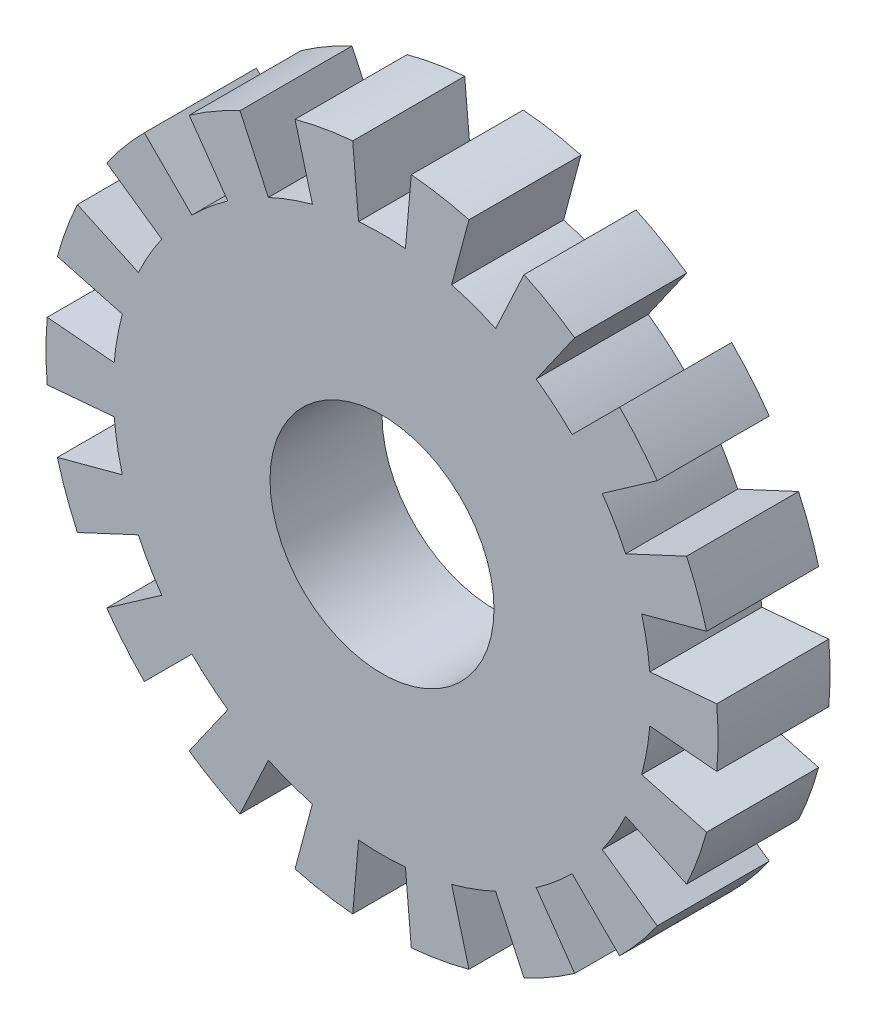
from build123d import *

# Parameters (mm, degrees)
SKETCH_1_R          = 15
EXTRUDE_1_DEPTH     = 5
CUT_EXTRUDE_1_REACH = 23.794
CUT_EXTRUDE_2_REACH = 23.755
SKETCH_3_R          = 5


with BuildPart() as part:
    # ｽｹｯﾁ1 → ﾎﾞｽ - 押し出し1 (new body)
    with BuildSketch(Plane.XY):
        Circle(SKETCH_1_R)
    extrude(amount=EXTRUDE_1_DEPTH)

    # ｽｹｯﾁ2 → ｶｯﾄ - 押し出し1 (cut, up to next)
    with BuildSketch(Plane(origin=(0, 0, 0), x_dir=(-1, 0, 0), z_dir=(0, 0, -1)), mode=Mode.PRIVATE) as cut_extrude_1_sk1:
        with BuildLine():
            Line((-6.882917236, 9.829824531), (-8.603646545, 12.287280664))
            ThreePointArc((-8.603646545, 12.287280664), (-9.641814145, 11.490666647), (-10.606601718, 10.606601718))
            Line((-10.606601718, 10.606601718), (-8.485281374, 8.485281374))
            ThreePointArc((-8.485281374, 8.485281374), (-7.713451316, 9.192533317), (-6.882917236, 9.829824531))
        make_face()
    cut_extrude_1_tool1 = extrude(cut_extrude_1_sk1.sketch, amount=-CUT_EXTRUDE_1_REACH, mode=Mode.PRIVATE) & part.part
    # ｽｹｯﾁ2 → ｶｯﾄ - 押し出し1 (cut, up to next)
    with BuildSketch(Plane(origin=(0, 0, 0), x_dir=(-1, 0, 0), z_dir=(0, 0, -1)), mode=Mode.PRIVATE) as cut_extrude_1_sk2:
        with BuildLine():
            Line((-3.105828541, 11.591109915), (-3.882285677, 14.488887394))
            ThreePointArc((-3.882285677, 14.488887394), (-5.13030215, 14.095389312), (-6.339273926, 13.594616806))
            Line((-6.339273926, 13.594616806), (-5.071419141, 10.875693444))
            ThreePointArc((-5.071419141, 10.875693444), (-4.10424172, 11.276311449), (-3.105828541, 11.591109915))
        make_face()
    cut_extrude_1_tool2 = extrude(cut_extrude_1_sk2.sketch, amount=-CUT_EXTRUDE_1_REACH, mode=Mode.PRIVATE) & part.part
    # ｽｹｯﾁ2 → ｶｯﾄ - 押し出し1 (cut, up to next)
    with BuildSketch(Plane(origin=(0, 0, 0), x_dir=(-1, 0, 0), z_dir=(0, 0, -1)), mode=Mode.PRIVATE) as cut_extrude_1_sk3:
        with BuildLine():
            ThreePointArc((0, 12), (0.523432648, 11.988578659), (1.045868913, 11.954336377))
            Line((1.045868913, 11.954336377), (1.307336141, 14.942920471))
            ThreePointArc((1.307336141, 14.942920471), (0.65429081, 14.985723324), (0, 15))
            Line((0, 15), (0, 12))
        make_face()
    cut_extrude_1_tool3 = extrude(cut_extrude_1_sk3.sketch, amount=-CUT_EXTRUDE_1_REACH, mode=Mode.PRIVATE) & part.part
    # ｽｹｯﾁ2 → ｶｯﾄ - 押し出し1 (cut, up to next)
    with BuildSketch(Plane(origin=(0, 0, 0), x_dir=(-1, 0, 0), z_dir=(0, 0, -1)), mode=Mode.PRIVATE) as cut_extrude_1_sk4:
        with BuildLine():
            ThreePointArc((-1.045868913, 11.954336377), (-0.523432648, 11.988578659), (0, 12))
            Line((0, 12), (0, 15))
            ThreePointArc((0, 15), (-0.65429081, 14.985723324), (-1.307336141, 14.942920471))
            Line((-1.307336141, 14.942920471), (-1.045868913, 11.954336377))
        make_face()
    cut_extrude_1_tool4 = extrude(cut_extrude_1_sk4.sketch, amount=-CUT_EXTRUDE_1_REACH, mode=Mode.PRIVATE) & part.part
    # ｽｹｯﾁ2 → ｶｯﾄ - 押し出し1 (cut, up to next)
    with BuildSketch(Plane(origin=(0, 0, 0), x_dir=(-1, 0, 0), z_dir=(0, 0, -1)), mode=Mode.PRIVATE) as cut_extrude_1_sk5:
        with BuildLine():
            ThreePointArc((6.339273926, 13.594616806), (5.13030215, 14.095389312), (3.882285677, 14.488887394))
            Line((3.882285677, 14.488887394), (3.105828541, 11.591109915))
            ThreePointArc((3.105828541, 11.591109915), (4.10424172, 11.276311449), (5.071419141, 10.875693444))
            Line((5.071419141, 10.875693444), (6.339273926, 13.594616806))
        make_face()
    cut_extrude_1_tool5 = extrude(cut_extrude_1_sk5.sketch, amount=-CUT_EXTRUDE_1_REACH, mode=Mode.PRIVATE) & part.part
    # ｽｹｯﾁ2 → ｶｯﾄ - 押し出し1 (cut, up to next)
    with BuildSketch(Plane(origin=(0, 0, 0), x_dir=(-1, 0, 0), z_dir=(0, 0, -1)), mode=Mode.PRIVATE) as cut_extrude_1_sk6:
        with BuildLine():
            ThreePointArc((10.606601718, 10.606601718), (9.641814145, 11.490666647), (8.603646545, 12.287280664))
            Line((8.603646545, 12.287280664), (6.882917236, 9.829824531))
            ThreePointArc((6.882917236, 9.829824531), (7.713451316, 9.192533317), (8.485281374, 8.485281374))
            Line((8.485281374, 8.485281374), (10.606601718, 10.606601718))
        make_face()
    cut_extrude_1_tool6 = extrude(cut_extrude_1_sk6.sketch, amount=-CUT_EXTRUDE_1_REACH, mode=Mode.PRIVATE) & part.part
    # ｽｹｯﾁ2 → ｶｯﾄ - 押し出し1 (cut, up to next)
    with BuildSketch(Plane(origin=(0, 0, 0), x_dir=(-1, 0, 0), z_dir=(0, 0, -1)), mode=Mode.PRIVATE) as cut_extrude_1_sk7:
        with BuildLine():
            ThreePointArc((13.594616806, 6.339273926), (12.990381057, 7.5), (12.287280664, 8.603646545))
            Line((12.287280664, 8.603646545), (9.829824531, 6.882917236))
            ThreePointArc((9.829824531, 6.882917236), (10.392304845, 6), (10.875693444, 5.071419141))
            Line((10.875693444, 5.071419141), (13.594616806, 6.339273926))
        make_face()
    cut_extrude_1_tool7 = extrude(cut_extrude_1_sk7.sketch, amount=-CUT_EXTRUDE_1_REACH, mode=Mode.PRIVATE) & part.part
    # ｽｹｯﾁ2 → ｶｯﾄ - 押し出し1 (cut, up to next)
    with BuildSketch(Plane(origin=(0, 0, 0), x_dir=(-1, 0, 0), z_dir=(0, 0, -1)), mode=Mode.PRIVATE) as cut_extrude_1_sk8:
        with BuildLine():
            ThreePointArc((14.942920471, 1.307336141), (14.772116295, 2.604722665), (14.488887394, 3.882285677))
            Line((14.488887394, 3.882285677), (11.591109915, 3.105828541))
            ThreePointArc((11.591109915, 3.105828541), (11.817693036, 2.083778132), (11.954336377, 1.045868913))
            Line((11.954336377, 1.045868913), (14.942920471, 1.307336141))
        make_face()
    cut_extrude_1_tool8 = extrude(cut_extrude_1_sk8.sketch, amount=-CUT_EXTRUDE_1_REACH, mode=Mode.PRIVATE) & part.part
    # ｽｹｯﾁ2 → ｶｯﾄ - 押し出し1 (cut, up to next)
    with BuildSketch(Plane(origin=(0, 0, 0), x_dir=(-1, 0, 0), z_dir=(0, 0, -1)), mode=Mode.PRIVATE) as cut_extrude_1_sk9:
        with BuildLine():
            ThreePointArc((14.488887394, -3.882285677), (14.772116295, -2.604722665), (14.942920471, -1.307336141))
            Line((14.942920471, -1.307336141), (11.954336377, -1.045868913))
            ThreePointArc((11.954336377, -1.045868913), (11.817693036, -2.083778132), (11.591109915, -3.105828541))
            Line((11.591109915, -3.105828541), (14.488887394, -3.882285677))
        make_face()
    cut_extrude_1_tool9 = extrude(cut_extrude_1_sk9.sketch, amount=-CUT_EXTRUDE_1_REACH, mode=Mode.PRIVATE) & part.part
    # ｽｹｯﾁ2 → ｶｯﾄ - 押し出し1 (cut, up to next)
    with BuildSketch(Plane(origin=(0, 0, 0), x_dir=(-1, 0, 0), z_dir=(0, 0, -1)), mode=Mode.PRIVATE) as cut_extrude_1_sk10:
        with BuildLine():
            Line((-9.829824531, 6.882917236), (-12.287280664, 8.603646545))
            ThreePointArc((-12.287280664, 8.603646545), (-12.990381057, 7.5), (-13.594616806, 6.339273926))
            Line((-13.594616806, 6.339273926), (-10.875693444, 5.071419141))
            ThreePointArc((-10.875693444, 5.071419141), (-10.392304845, 6), (-9.829824531, 6.882917236))
        make_face()
    cut_extrude_1_tool10 = extrude(cut_extrude_1_sk10.sketch, amount=-CUT_EXTRUDE_1_REACH, mode=Mode.PRIVATE) & part.part
    # ｽｹｯﾁ2 → ｶｯﾄ - 押し出し1 (cut, up to next)
    with BuildSketch(Plane(origin=(0, 0, 0), x_dir=(-1, 0, 0), z_dir=(0, 0, -1)), mode=Mode.PRIVATE) as cut_extrude_1_sk11:
        with BuildLine():
            Line((-11.591109915, 3.105828541), (-14.488887394, 3.882285677))
            ThreePointArc((-14.488887394, 3.882285677), (-14.772116295, 2.604722665), (-14.942920471, 1.307336141))
            Line((-14.942920471, 1.307336141), (-11.954336377, 1.045868913))
            ThreePointArc((-11.954336377, 1.045868913), (-11.817693036, 2.083778132), (-11.591109915, 3.105828541))
        make_face()
    cut_extrude_1_tool11 = extrude(cut_extrude_1_sk11.sketch, amount=-CUT_EXTRUDE_1_REACH, mode=Mode.PRIVATE) & part.part
    # ｽｹｯﾁ2 → ｶｯﾄ - 押し出し1 (cut, up to next)
    with BuildSketch(Plane(origin=(0, 0, 0), x_dir=(-1, 0, 0), z_dir=(0, 0, -1)), mode=Mode.PRIVATE) as cut_extrude_1_sk12:
        with BuildLine():
            Line((-11.954336377, -1.045868913), (-14.942920471, -1.307336141))
            ThreePointArc((-14.942920471, -1.307336141), (-14.772116295, -2.604722665), (-14.488887394, -3.882285677))
            Line((-14.488887394, -3.882285677), (-11.591109915, -3.105828541))
            ThreePointArc((-11.591109915, -3.105828541), (-11.817693036, -2.083778132), (-11.954336377, -1.045868913))
        make_face()
    cut_extrude_1_tool12 = extrude(cut_extrude_1_sk12.sketch, amount=-CUT_EXTRUDE_1_REACH, mode=Mode.PRIVATE) & part.part
    # ｽｹｯﾁ2 → ｶｯﾄ - 押し出し1 (cut, up to next)
    with BuildSketch(Plane(origin=(0, 0, 0), x_dir=(-1, 0, 0), z_dir=(0, 0, -1)), mode=Mode.PRIVATE) as cut_extrude_1_sk13:
        with BuildLine():
            Line((-10.875693444, -5.071419141), (-13.594616806, -6.339273926))
            ThreePointArc((-13.594616806, -6.339273926), (-12.990381057, -7.5), (-12.287280664, -8.603646545))
            Line((-12.287280664, -8.603646545), (-9.829824531, -6.882917236))
            ThreePointArc((-9.829824531, -6.882917236), (-10.392304845, -6), (-10.875693444, -5.071419141))
        make_face()
    cut_extrude_1_tool13 = extrude(cut_extrude_1_sk13.sketch, amount=-CUT_EXTRUDE_1_REACH, mode=Mode.PRIVATE) & part.part
    # ｽｹｯﾁ2 → ｶｯﾄ - 押し出し1 (cut, up to next)
    with BuildSketch(Plane(origin=(0, 0, 0), x_dir=(-1, 0, 0), z_dir=(0, 0, -1)), mode=Mode.PRIVATE) as cut_extrude_1_sk14:
        with BuildLine():
            Line((-8.485281374, -8.485281374), (-10.606601718, -10.606601718))
            ThreePointArc((-10.606601718, -10.606601718), (-9.641814145, -11.490666647), (-8.603646545, -12.287280664))
            Line((-8.603646545, -12.287280664), (-6.882917236, -9.829824531))
            ThreePointArc((-6.882917236, -9.829824531), (-7.713451316, -9.192533317), (-8.485281374, -8.485281374))
        make_face()
    cut_extrude_1_tool14 = extrude(cut_extrude_1_sk14.sketch, amount=-CUT_EXTRUDE_1_REACH, mode=Mode.PRIVATE) & part.part
    # ｽｹｯﾁ2 → ｶｯﾄ - 押し出し1 (cut, up to next)
    with BuildSketch(Plane(origin=(0, 0, 0), x_dir=(-1, 0, 0), z_dir=(0, 0, -1)), mode=Mode.PRIVATE) as cut_extrude_1_sk15:
        with BuildLine():
            Line((-5.071419141, -10.875693444), (-6.339273926, -13.594616806))
            ThreePointArc((-6.339273926, -13.594616806), (-5.13030215, -14.095389312), (-3.882285677, -14.488887394))
            Line((-3.882285677, -14.488887394), (-3.105828541, -11.591109915))
            ThreePointArc((-3.105828541, -11.591109915), (-4.10424172, -11.276311449), (-5.071419141, -10.875693444))
        make_face()
    cut_extrude_1_tool15 = extrude(cut_extrude_1_sk15.sketch, amount=-CUT_EXTRUDE_1_REACH, mode=Mode.PRIVATE) & part.part
    # ｽｹｯﾁ2 → ｶｯﾄ - 押し出し1 (cut, up to next)
    with BuildSketch(Plane(origin=(0, 0, 0), x_dir=(-1, 0, 0), z_dir=(0, 0, -1)), mode=Mode.PRIVATE) as cut_extrude_1_sk16:
        with BuildLine():
            ThreePointArc((-1.307336141, -14.942920471), (0, -15), (1.307336141, -14.942920471))
            Line((1.307336141, -14.942920471), (1.045868913, -11.954336377))
            ThreePointArc((1.045868913, -11.954336377), (0, -12), (-1.045868913, -11.954336377))
            Line((-1.045868913, -11.954336377), (-1.307336141, -14.942920471))
        make_face()
    cut_extrude_1_tool16 = extrude(cut_extrude_1_sk16.sketch, amount=-CUT_EXTRUDE_1_REACH, mode=Mode.PRIVATE) & part.part
    # ｽｹｯﾁ2 → ｶｯﾄ - 押し出し1 (cut, up to next)
    with BuildSketch(Plane(origin=(0, 0, 0), x_dir=(-1, 0, 0), z_dir=(0, 0, -1)), mode=Mode.PRIVATE) as cut_extrude_1_sk17:
        with BuildLine():
            ThreePointArc((3.882285677, -14.488887394), (5.13030215, -14.095389312), (6.339273926, -13.594616806))
            Line((6.339273926, -13.594616806), (5.071419141, -10.875693444))
            ThreePointArc((5.071419141, -10.875693444), (4.10424172, -11.276311449), (3.105828541, -11.591109915))
            Line((3.105828541, -11.591109915), (3.882285677, -14.488887394))
        make_face()
    cut_extrude_1_tool17 = extrude(cut_extrude_1_sk17.sketch, amount=-CUT_EXTRUDE_1_REACH, mode=Mode.PRIVATE) & part.part
    # ｽｹｯﾁ2 → ｶｯﾄ - 押し出し1 (cut, up to next)
    with BuildSketch(Plane(origin=(0, 0, 0), x_dir=(-1, 0, 0), z_dir=(0, 0, -1)), mode=Mode.PRIVATE) as cut_extrude_1_sk18:
        with BuildLine():
            ThreePointArc((8.603646545, -12.287280664), (9.641814145, -11.490666647), (10.606601718, -10.606601718))
            Line((10.606601718, -10.606601718), (8.485281374, -8.485281374))
            ThreePointArc((8.485281374, -8.485281374), (7.713451316, -9.192533317), (6.882917236, -9.829824531))
            Line((6.882917236, -9.829824531), (8.603646545, -12.287280664))
        make_face()
    cut_extrude_1_tool18 = extrude(cut_extrude_1_sk18.sketch, amount=-CUT_EXTRUDE_1_REACH, mode=Mode.PRIVATE) & part.part
    # ｽｹｯﾁ2 → ｶｯﾄ - 押し出し1 (cut, up to next)
    with BuildSketch(Plane(origin=(0, 0, 0), x_dir=(-1, 0, 0), z_dir=(0, 0, -1)), mode=Mode.PRIVATE) as cut_extrude_1_sk19:
        with BuildLine():
            ThreePointArc((12.287280664, -8.603646545), (12.990381057, -7.5), (13.594616806, -6.339273926))
            Line((13.594616806, -6.339273926), (10.875693444, -5.071419141))
            ThreePointArc((10.875693444, -5.071419141), (10.392304845, -6), (9.829824531, -6.882917236))
            Line((9.829824531, -6.882917236), (12.287280664, -8.603646545))
        make_face()
    cut_extrude_1_tool19 = extrude(cut_extrude_1_sk19.sketch, amount=-CUT_EXTRUDE_1_REACH, mode=Mode.PRIVATE) & part.part
    add(cut_extrude_1_tool1.solids().sort_by_distance((8.702288, 10.370983, 0))[0], mode=Mode.SUBTRACT)
    add(cut_extrude_1_tool2.solids().sort_by_distance((4.630391, 12.721894, 0))[0], mode=Mode.SUBTRACT)
    add(cut_extrude_1_tool3.solids().sort_by_distance((-0.591097, 13.538357, 0))[0], mode=Mode.SUBTRACT)
    add(cut_extrude_1_tool4.solids().sort_by_distance((0.591097, 13.538357, 0))[0], mode=Mode.SUBTRACT)
    add(cut_extrude_1_tool5.solids().sort_by_distance((-4.630391, 12.721894, 0))[0], mode=Mode.SUBTRACT)
    add(cut_extrude_1_tool6.solids().sort_by_distance((-8.702288, 10.370983, 0))[0], mode=Mode.SUBTRACT)
    add(cut_extrude_1_tool7.solids().sort_by_distance((-11.724561, 6.769178, 0))[0], mode=Mode.SUBTRACT)
    add(cut_extrude_1_tool8.solids().sort_by_distance((-13.332679, 2.350911, 0))[0], mode=Mode.SUBTRACT)
    add(cut_extrude_1_tool9.solids().sort_by_distance((-13.332679, -2.350911, 0))[0], mode=Mode.SUBTRACT)
    add(cut_extrude_1_tool10.solids().sort_by_distance((11.724561, 6.769178, 0))[0], mode=Mode.SUBTRACT)
    add(cut_extrude_1_tool11.solids().sort_by_distance((13.332679, 2.350911, 0))[0], mode=Mode.SUBTRACT)
    add(cut_extrude_1_tool12.solids().sort_by_distance((13.332679, -2.350911, 0))[0], mode=Mode.SUBTRACT)
    add(cut_extrude_1_tool13.solids().sort_by_distance((11.724561, -6.769178, 0))[0], mode=Mode.SUBTRACT)
    add(cut_extrude_1_tool14.solids().sort_by_distance((8.702288, -10.370983, 0))[0], mode=Mode.SUBTRACT)
    add(cut_extrude_1_tool15.solids().sort_by_distance((4.630391, -12.721894, 0))[0], mode=Mode.SUBTRACT)
    add(cut_extrude_1_tool16.solids().sort_by_distance((0, -13.538357, 0))[0], mode=Mode.SUBTRACT)
    add(cut_extrude_1_tool17.solids().sort_by_distance((-4.630391, -12.721894, 0))[0], mode=Mode.SUBTRACT)
    add(cut_extrude_1_tool18.solids().sort_by_distance((-8.702288, -10.370983, 0))[0], mode=Mode.SUBTRACT)
    add(cut_extrude_1_tool19.solids().sort_by_distance((-11.724561, -6.769178, 0))[0], mode=Mode.SUBTRACT)

    # ｽｹｯﾁ3 → ｶｯﾄ - 押し出し2 (cut, up to next)
    with BuildSketch(Plane(origin=(0, 0, 0), x_dir=(-1, 0, 0), z_dir=(0, 0, -1)), mode=Mode.PRIVATE) as cut_extrude_2_sk1:
        Circle(SKETCH_3_R)
    cut_extrude_2_tool1 = extrude(cut_extrude_2_sk1.sketch, amount=-CUT_EXTRUDE_2_REACH, mode=Mode.PRIVATE) & part.part
    add(cut_extrude_2_tool1.solids().sort_by_distance((0, 0, 0))[0], mode=Mode.SUBTRACT)


solid = part.part
